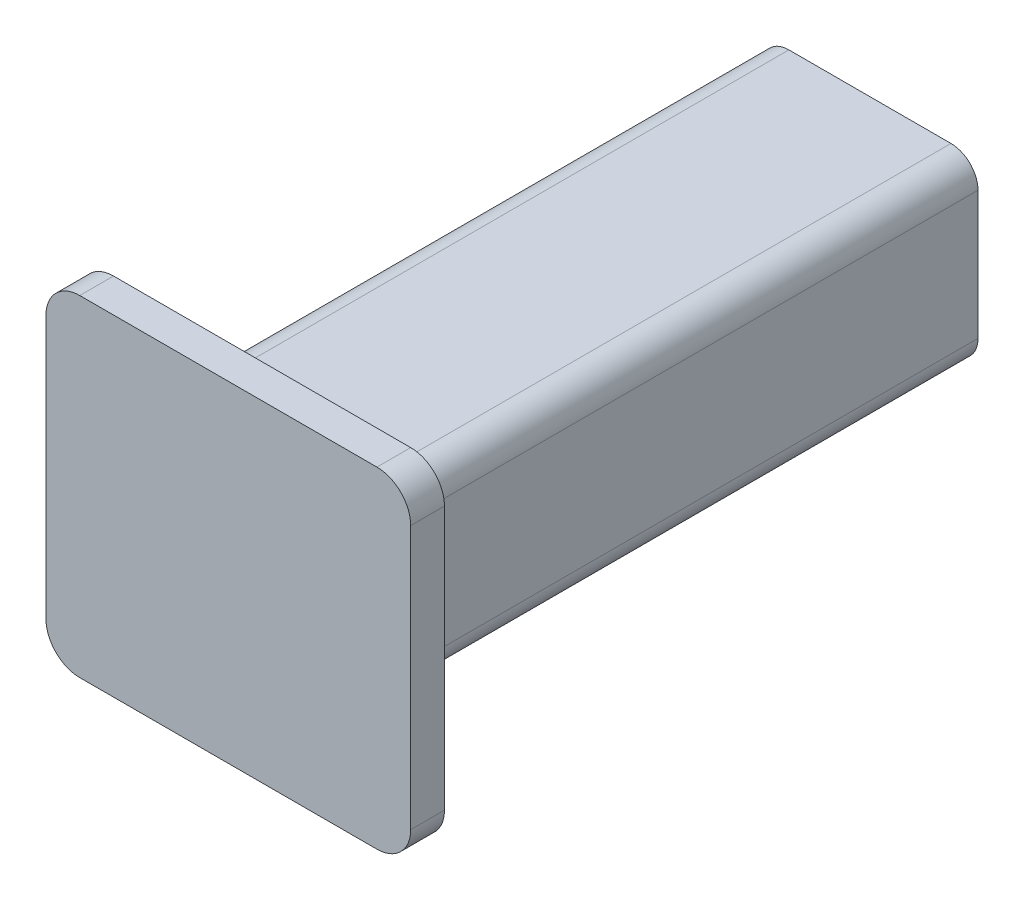
from build123d import *

# Parameters (mm, degrees)
EXTRUDE_1_DEPTH = 1
EXTRUDE_2_DEPTH = 18


with BuildPart() as part:
    # 草图1 → 凸台-拉伸1 (new body)
    with BuildSketch(Plane.XY):
        with BuildLine():
            Line((-3.132848788, 7.321546969), (5.667151212, 7.321546969))
            ThreePointArc((5.667151212, 7.321546969), (6.374257994, 7.02865375), (6.667151212, 6.321546969))
            Line((6.667151212, 6.321546969), (6.667151212, -1.478453031))
            ThreePointArc((6.667151212, -1.478453031), (6.374257994, -2.185559812), (5.667151212, -2.478453031))
            Line((5.667151212, -2.478453031), (-3.132848788, -2.478453031))
            ThreePointArc((-3.132848788, -2.478453031), (-3.839955569, -2.185559812), (-4.132848788, -1.478453031))
            Line((-4.132848788, -1.478453031), (-4.132848788, 6.321546969))
            ThreePointArc((-4.132848788, 6.321546969), (-3.839955569, 7.02865375), (-3.132848788, 7.321546969))
        make_face()
    extrude(amount=EXTRUDE_1_DEPTH)

    # 草图2 → 凸台-拉伸2 (add)
    with BuildSketch(Plane(origin=(0, 0, 0), x_dir=(-1, 0, 0), z_dir=(0, 0, -1))):
        with BuildLine():
            Line((-3.667151212, 5.121546969), (1.132848788, 5.121546969))
            ThreePointArc((1.132848788, 5.121546969), (1.698534213, 4.887232394), (1.932848788, 4.321546969))
            Line((1.932848788, 4.321546969), (1.932848788, 0.521546969))
            ThreePointArc((1.932848788, 0.521546969), (1.698534213, -0.044138456), (1.132848788, -0.278453031))
            Line((1.132848788, -0.278453031), (-3.667151212, -0.278453031))
            ThreePointArc((-3.667151212, -0.278453031), (-4.232836637, -0.044138456), (-4.467151212, 0.521546969))
            Line((-4.467151212, 0.521546969), (-4.467151212, 4.321546969))
            ThreePointArc((-4.467151212, 4.321546969), (-4.232836637, 4.887232394), (-3.667151212, 5.121546969))
        make_face()
    extrude(amount=EXTRUDE_2_DEPTH)


solid = part.part
